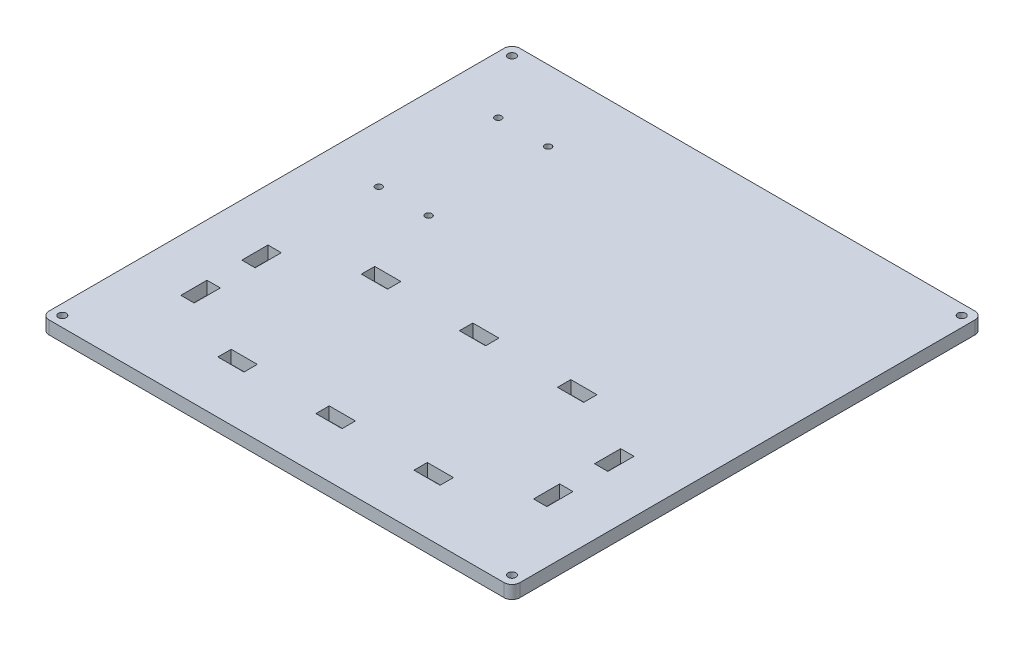
from build123d import *

# Parameters (mm, degrees)
SKETCH1_W           = 180
SKETCH1_H           = 180
SKETCH1_R           = 1.5
SKETCH1_W_2         = 22.7
SKETCH1_H_2         = 50.8
SKETCH1_R_2         = 1.27
BOSS_EXTRUDE1_DEPTH = 5
CUT_EXTRUDE1_REACH  = 129.377
SKETCH4_W           = 10
SKETCH4_H           = 5.1
SKETCH4_W_2         = 5.1
SKETCH4_H_2         = 10
FILLET1_R           = 3


with BuildPart() as part:
    # Sketch1 → Boss-Extrude1 (new body)
    # profile 1 of 2: a face of its own
    with BuildSketch(Plane(origin=(0, 0, 0), x_dir=(1, 0, 0), z_dir=(0, 1, 0))):
        Rectangle(SKETCH1_W, SKETCH1_H)
        with Locations(Location((-86, -86, 0), (0, 0, 270))):
            Circle(SKETCH1_R, mode=Mode.SUBTRACT)
        with Locations(Location((86, -86, 0), (0, 0, 270))):
            Circle(SKETCH1_R, mode=Mode.SUBTRACT)
        with Locations(Location((86, 86, 0), (0, 0, 270))):
            Circle(SKETCH1_R, mode=Mode.SUBTRACT)
        with Locations(Location((-86, 86, 0), (0, 0, 270))):
            Circle(SKETCH1_R, mode=Mode.SUBTRACT)
        with Locations((-58.65, 40)):
            Rectangle(SKETCH1_W_2, SKETCH1_H_2, mode=Mode.SUBTRACT)
    # profile 2 of 2: a face of its own
    with BuildSketch(Plane(origin=(0, 0, 0), x_dir=(1, 0, 0), z_dir=(0, 1, 0))):
        with Locations((-58.65, 40)):
            Rectangle(SKETCH1_W_2, SKETCH1_H_2)
        with Locations(Location((-68.095, 17.14, 0), (0, 0, 270))):
            Circle(SKETCH1_R_2, mode=Mode.SUBTRACT)
        with Locations(Location((-49.045, 17.14, 0), (0, 0, 270))):
            Circle(SKETCH1_R_2, mode=Mode.SUBTRACT)
        with Locations(Location((-49.045, 62.86, 0), (0, 0, 270))):
            Circle(SKETCH1_R_2, mode=Mode.SUBTRACT)
        with Locations(Location((-68.095, 62.86, 0), (0, 0, 270))):
            Circle(SKETCH1_R_2, mode=Mode.SUBTRACT)
    extrude(amount=BOSS_EXTRUDE1_DEPTH)

    # Sketch4 → Cut-Extrude1 (cut, up to next)
    with BuildSketch(Plane(origin=(0, 5, 0), x_dir=(1, 0, 0), z_dir=(0, 1, 0)), mode=Mode.PRIVATE) as cut_extrude1_sk1:
        with Locations((37.5, -12.55)):
            Rectangle(SKETCH4_W, SKETCH4_H)
    cut_extrude1_tool1 = extrude(cut_extrude1_sk1.sketch, amount=-CUT_EXTRUDE1_REACH, mode=Mode.PRIVATE) & part.part
    # Sketch4 → Cut-Extrude1 (cut, up to next)
    with BuildSketch(Plane(origin=(0, 5, 0), x_dir=(1, 0, 0), z_dir=(0, 1, 0)), mode=Mode.PRIVATE) as cut_extrude1_sk2:
        with Locations((0, -12.55)):
            Rectangle(SKETCH4_W, SKETCH4_H)
    cut_extrude1_tool2 = extrude(cut_extrude1_sk2.sketch, amount=-CUT_EXTRUDE1_REACH, mode=Mode.PRIVATE) & part.part
    # Sketch4 → Cut-Extrude1 (cut, up to next)
    with BuildSketch(Plane(origin=(0, 5, 0), x_dir=(1, 0, 0), z_dir=(0, 1, 0)), mode=Mode.PRIVATE) as cut_extrude1_sk3:
        with Locations((-37.5, -12.55)):
            Rectangle(SKETCH4_W, SKETCH4_H)
    cut_extrude1_tool3 = extrude(cut_extrude1_sk3.sketch, amount=-CUT_EXTRUDE1_REACH, mode=Mode.PRIVATE) & part.part
    # Sketch4 → Cut-Extrude1 (cut, up to next)
    with BuildSketch(Plane(origin=(0, 5, 0), x_dir=(1, 0, 0), z_dir=(0, 1, 0)), mode=Mode.PRIVATE) as cut_extrude1_sk4:
        with Locations((37.5, -67.45)):
            Rectangle(SKETCH4_W, SKETCH4_H)
    cut_extrude1_tool4 = extrude(cut_extrude1_sk4.sketch, amount=-CUT_EXTRUDE1_REACH, mode=Mode.PRIVATE) & part.part
    # Sketch4 → Cut-Extrude1 (cut, up to next)
    with BuildSketch(Plane(origin=(0, 5, 0), x_dir=(1, 0, 0), z_dir=(0, 1, 0)), mode=Mode.PRIVATE) as cut_extrude1_sk5:
        with Locations((0, -67.45)):
            Rectangle(SKETCH4_W, SKETCH4_H)
    cut_extrude1_tool5 = extrude(cut_extrude1_sk5.sketch, amount=-CUT_EXTRUDE1_REACH, mode=Mode.PRIVATE) & part.part
    # Sketch4 → Cut-Extrude1 (cut, up to next)
    with BuildSketch(Plane(origin=(0, 5, 0), x_dir=(1, 0, 0), z_dir=(0, 1, 0)), mode=Mode.PRIVATE) as cut_extrude1_sk6:
        with Locations((-37.5, -67.45)):
            Rectangle(SKETCH4_W, SKETCH4_H)
    cut_extrude1_tool6 = extrude(cut_extrude1_sk6.sketch, amount=-CUT_EXTRUDE1_REACH, mode=Mode.PRIVATE) & part.part
    # Sketch4 → Cut-Extrude1 (cut, up to next)
    with BuildSketch(Plane(origin=(0, 5, 0), x_dir=(1, 0, 0), z_dir=(0, 1, 0)), mode=Mode.PRIVATE) as cut_extrude1_sk7:
        with Locations((-67.45, -51.666666667)):
            Rectangle(SKETCH4_W_2, SKETCH4_H_2)
    cut_extrude1_tool7 = extrude(cut_extrude1_sk7.sketch, amount=-CUT_EXTRUDE1_REACH, mode=Mode.PRIVATE) & part.part
    # Sketch4 → Cut-Extrude1 (cut, up to next)
    with BuildSketch(Plane(origin=(0, 5, 0), x_dir=(1, 0, 0), z_dir=(0, 1, 0)), mode=Mode.PRIVATE) as cut_extrude1_sk8:
        with Locations((-67.45, -28.333333333)):
            Rectangle(SKETCH4_W_2, SKETCH4_H_2)
    cut_extrude1_tool8 = extrude(cut_extrude1_sk8.sketch, amount=-CUT_EXTRUDE1_REACH, mode=Mode.PRIVATE) & part.part
    # Sketch4 → Cut-Extrude1 (cut, up to next)
    with BuildSketch(Plane(origin=(0, 5, 0), x_dir=(1, 0, 0), z_dir=(0, 1, 0)), mode=Mode.PRIVATE) as cut_extrude1_sk9:
        with Locations((67.45, -28.333333333)):
            Rectangle(SKETCH4_W_2, SKETCH4_H_2)
    cut_extrude1_tool9 = extrude(cut_extrude1_sk9.sketch, amount=-CUT_EXTRUDE1_REACH, mode=Mode.PRIVATE) & part.part
    # Sketch4 → Cut-Extrude1 (cut, up to next)
    with BuildSketch(Plane(origin=(0, 5, 0), x_dir=(1, 0, 0), z_dir=(0, 1, 0)), mode=Mode.PRIVATE) as cut_extrude1_sk10:
        with Locations((67.45, -51.666666667)):
            Rectangle(SKETCH4_W_2, SKETCH4_H_2)
    cut_extrude1_tool10 = extrude(cut_extrude1_sk10.sketch, amount=-CUT_EXTRUDE1_REACH, mode=Mode.PRIVATE) & part.part
    add(cut_extrude1_tool1.solids().sort_by_distance((37.5, 5, 12.55))[0], mode=Mode.SUBTRACT)
    add(cut_extrude1_tool2.solids().sort_by_distance((0, 5, 12.55))[0], mode=Mode.SUBTRACT)
    add(cut_extrude1_tool3.solids().sort_by_distance((-37.5, 5, 12.55))[0], mode=Mode.SUBTRACT)
    add(cut_extrude1_tool4.solids().sort_by_distance((37.5, 5, 67.45))[0], mode=Mode.SUBTRACT)
    add(cut_extrude1_tool5.solids().sort_by_distance((0, 5, 67.45))[0], mode=Mode.SUBTRACT)
    add(cut_extrude1_tool6.solids().sort_by_distance((-37.5, 5, 67.45))[0], mode=Mode.SUBTRACT)
    add(cut_extrude1_tool7.solids().sort_by_distance((-67.45, 5, 51.666667))[0], mode=Mode.SUBTRACT)
    add(cut_extrude1_tool8.solids().sort_by_distance((-67.45, 5, 28.333333))[0], mode=Mode.SUBTRACT)
    add(cut_extrude1_tool9.solids().sort_by_distance((67.45, 5, 28.333333))[0], mode=Mode.SUBTRACT)
    add(cut_extrude1_tool10.solids().sort_by_distance((67.45, 5, 51.666667))[0], mode=Mode.SUBTRACT)

    # Fillet1
    fillet1_edges = [part.edges().sort_by_distance(p)[0] for p in [
        (-90, 2.5, 90),
        (-90, 2.5, -90),
        (90, 2.5, -90),
        (90, 2.5, 90),
    ]]
    fillet(fillet1_edges, radius=FILLET1_R)


solid = part.part
